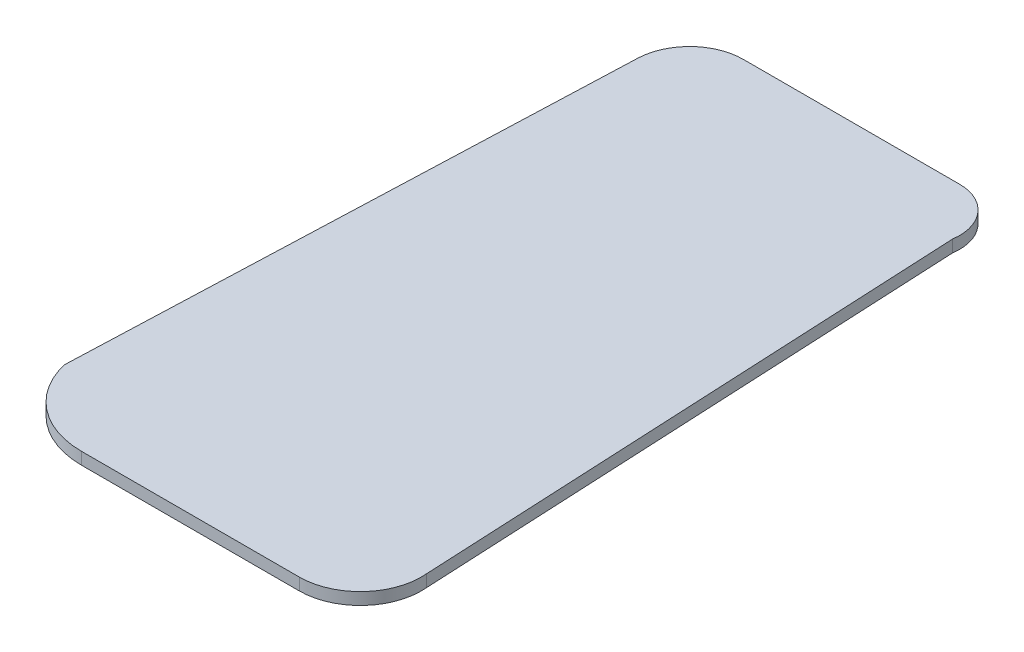
from build123d import *

# Parameters (mm, degrees)
BOSS_EXTRUDE1_DEPTH = 2.54


with BuildPart() as part:
    # Sketch2 → Boss-Extrude1 (new body)
    with BuildSketch(Plane(origin=(0, 0, 0), x_dir=(1, 0, 0), z_dir=(0, 1, 0))):
        with BuildLine():
            Line((7.237147433, 17.386016579), (11.707051133, 133.901506381))
            ThreePointArc((11.707051133, 133.901506381), (15.231568814, 141.521493404), (23.030807176, 144.629275263))
            Line((23.030807176, 144.629275263), (68.623824924, 144.629275263))
            ThreePointArc((68.623824924, 144.629275263), (75.702348643, 141.383399713), (77.861625906, 133.901506381))
            Line((77.861625906, 133.901506381), (83.523503927, 17.386016579))
            ThreePointArc((83.523503927, 17.386016579), (80.201238053, 7.561090167), (70.709779985, 3.380318317))
            Line((70.709779985, 3.380318317), (24.818768656, 3.380318317))
            ThreePointArc((24.818768656, 3.380318317), (13.57962958, 7.309733844), (7.237147433, 17.386016579))
        make_face()
    extrude(amount=BOSS_EXTRUDE1_DEPTH)


solid = part.part
